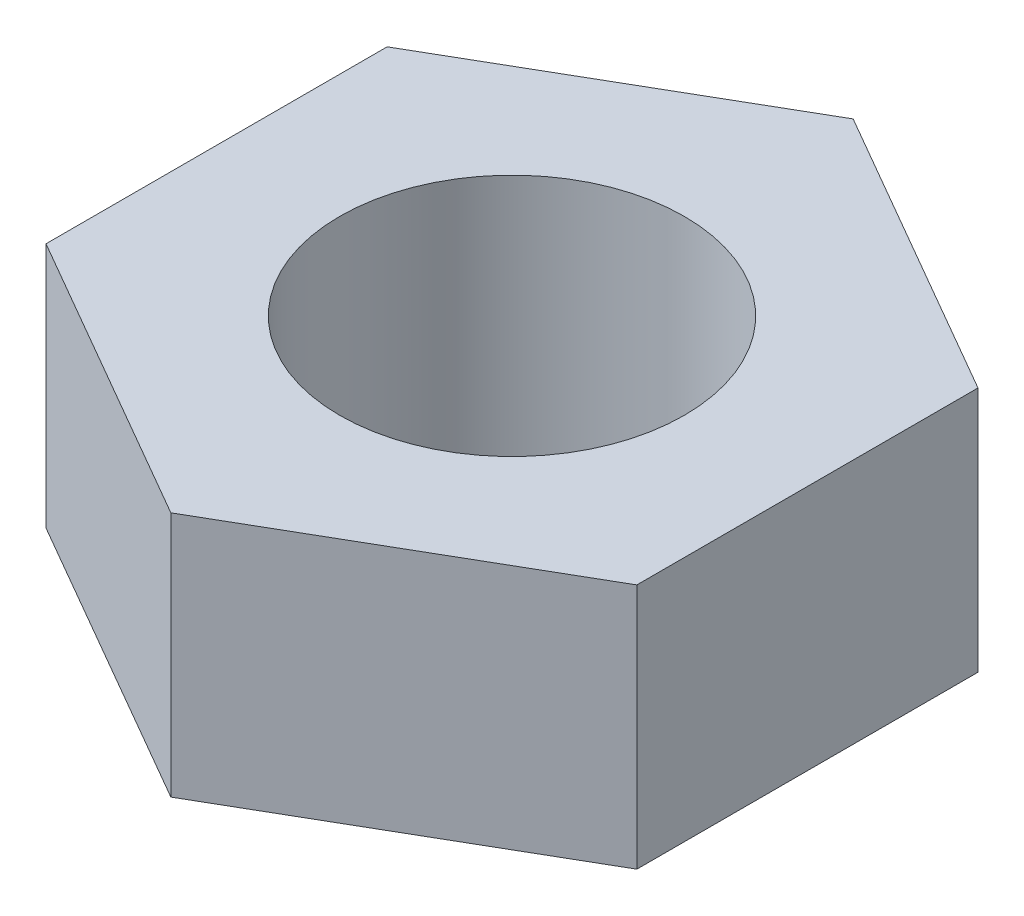
from build123d import *

# Parameters (mm, degrees)
SKETCH2_R           = 7
BOSS_EXTRUDE1_DEPTH = 10


with BuildPart() as part:
    # Sketch2 → Boss-Extrude1 (new body)
    with BuildSketch(Plane(origin=(0, 0, 0), x_dir=(1, 0, 0), z_dir=(0, 1, 0))):
        Polygon((12, -6.92820323), (12, 6.92820323), (0, 13.856406461), (-12, 6.92820323), (-12, -6.92820323), (0, -13.856406461), align=None)
        with Locations(Location((0, 0, 0), (0, 0, 270))):
            Circle(SKETCH2_R, mode=Mode.SUBTRACT)
    extrude(amount=BOSS_EXTRUDE1_DEPTH)


solid = part.part
